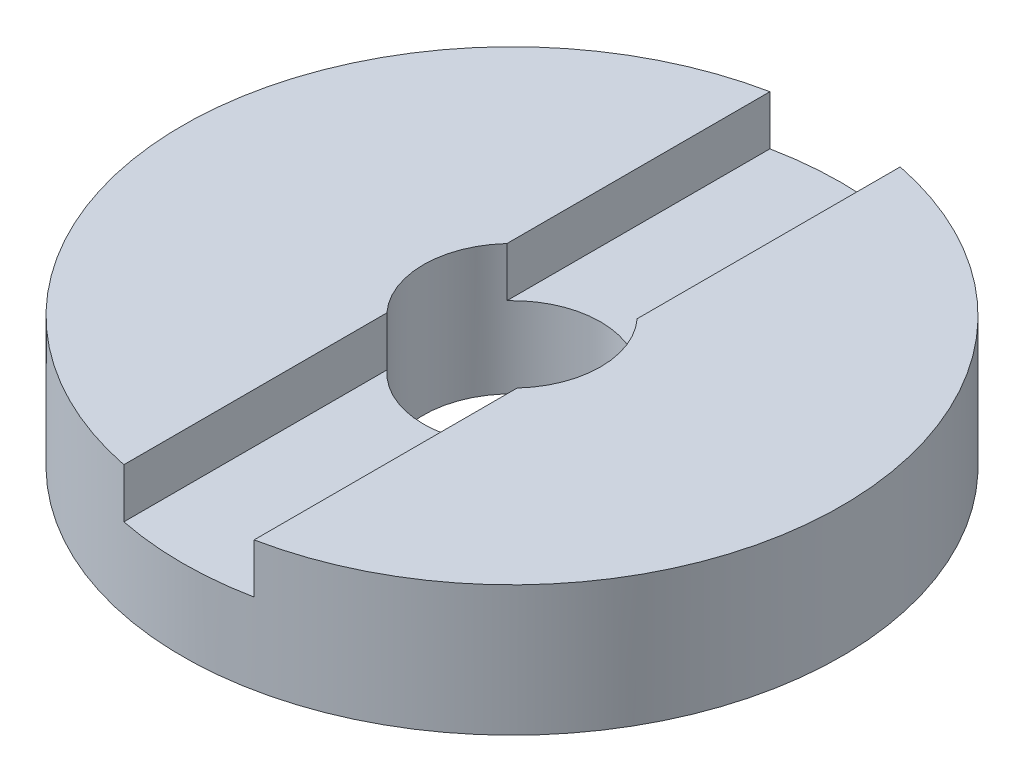
from build123d import *

# Parameters (mm, degrees)
ESQUISSE1_W             = 10.15
ESQUISSE1_H             = 5
ENL_V_MAT_EXTRU_1_DEPTH = 1.9
TROU_TARAUD_M81_D       = 6.8
TROU_TARAUD_M81_DEPTH   = 22.25
TROU_TARAUD_M81_TIP     = 2.042926105


with BuildPart() as part:
    # Esquisse1 → Révolution1 (revolve)
    with BuildSketch(Plane.XY, mode=Mode.PRIVATE) as r_volution1_sk:
        with Locations((-7.575, 2.5)):
            Rectangle(ESQUISSE1_W, ESQUISSE1_H)
    revolve(r_volution1_sk.sketch.rotate(Axis((0, 0, 0), (0, 1, 0)), 270), axis=Axis((0, 0, 0), (0, 1, 0)))

    # Esquisse2 → Enlèv. mat.-Extru.1 (cut)
    with BuildSketch(Plane(origin=(0, 5, 0), x_dir=(1, 0, 0), z_dir=(0, 1, 0))):
        with BuildLine():
            Line((-2.5, 12.400504022), (-2.5, -12.400504022))
            ThreePointArc((-2.5, -12.400504022), (0, -12.65), (2.5, -12.400504022))
            Line((2.5, -12.400504022), (2.5, 12.400504022))
            ThreePointArc((2.5, 12.400504022), (0, 12.65), (-2.5, 12.400504022))
        make_face()
    extrude(amount=-ENL_V_MAT_EXTRU_1_DEPTH, mode=Mode.SUBTRACT)

    # Trou taraudé M81
    with Locations(Plane.XZ):
        with Locations((0, 0)):
            Hole(TROU_TARAUD_M81_D / 2, depth=TROU_TARAUD_M81_DEPTH)
            with Locations((0, 0, -(TROU_TARAUD_M81_DEPTH + TROU_TARAUD_M81_TIP / 2))):  # 118° drill point
                Cone(0, TROU_TARAUD_M81_D / 2, TROU_TARAUD_M81_TIP, mode=Mode.SUBTRACT)


solid = part.part
